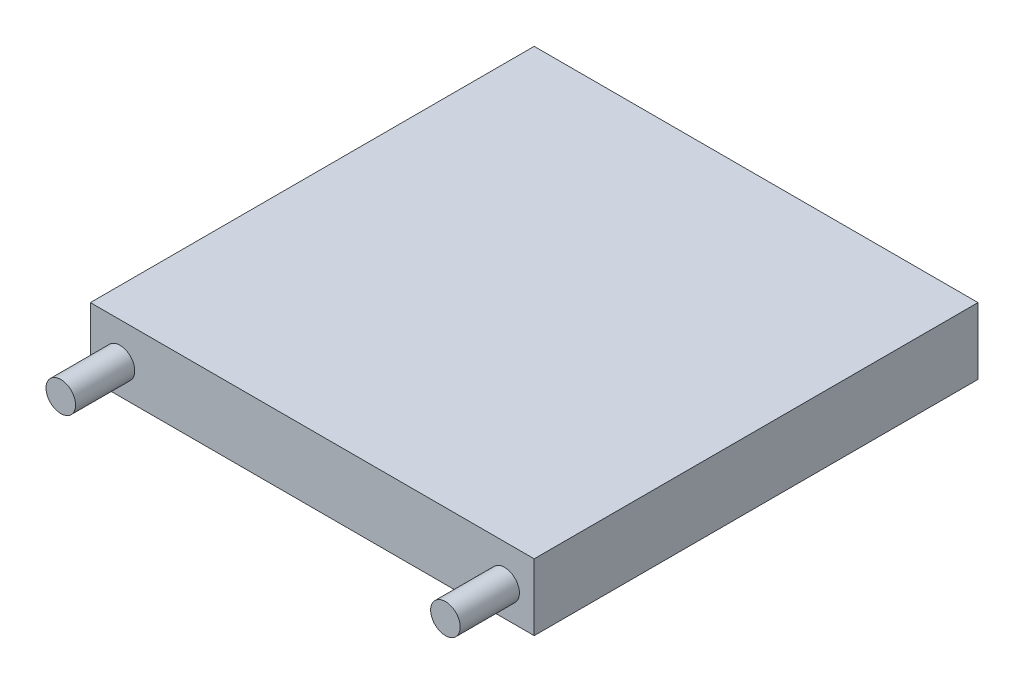
from build123d import *

# Parameters (mm, degrees)
SKETCH1_W           = 30
SKETCH1_H           = 30
BOSS_EXTRUDE1_DEPTH = 4.5
SKETCH2_R           = 1
BOSS_EXTRUDE2_DEPTH = 4


with BuildPart() as part:
    # Sketch1 → Boss-Extrude1 (new body)
    with BuildSketch(Plane(origin=(0, 0, 0), x_dir=(1, 0, 0), z_dir=(0, 1, 0))):
        Rectangle(SKETCH1_W, SKETCH1_H)
    extrude(amount=BOSS_EXTRUDE1_DEPTH)

    # Sketch2 → Boss-Extrude2 (add)
    with BuildSketch(Plane.XY.offset(15)):
        with Locations(Location((-13, 2, 0), (0, 0, 180))):
            Circle(SKETCH2_R)
        with Locations(Location((13, 2, 0), (0, 0, 180))):
            Circle(SKETCH2_R)
    extrude(amount=BOSS_EXTRUDE2_DEPTH)


solid = part.part
